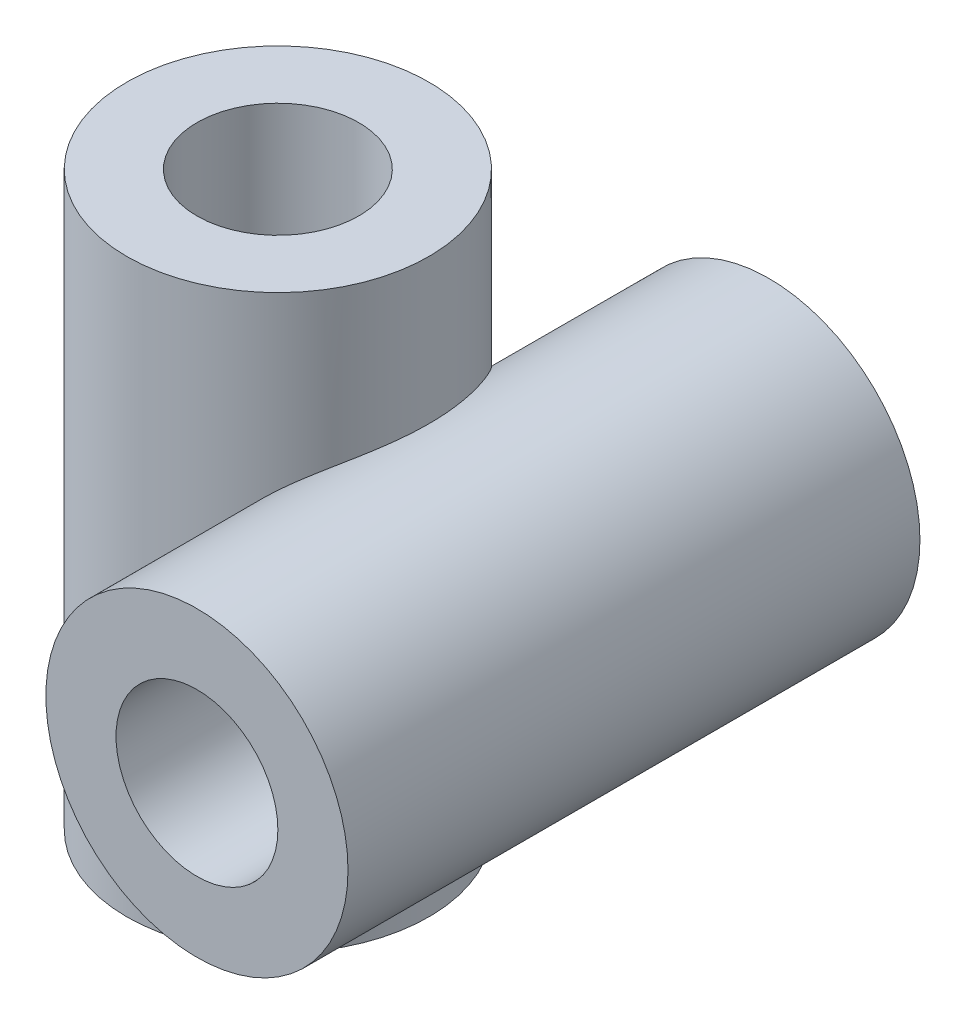
from build123d import *

# Parameters (mm, degrees)
SKETCH1_R           = 28
SKETCH1_R_2         = 15
BOSS_EXTRUDE1_DEPTH = 106
BOSS_EXTRUDE3_DEPTH = 53
CUT_EXTRUDE1_DEPTH  = 128
CUT_EXTRUDE2_DEPTH  = 123


with BuildPart() as part:
    # Sketch1 → Boss-Extrude1 (new body)
    with BuildSketch(Plane.XY):
        Circle(SKETCH1_R)
        Circle(SKETCH1_R_2, mode=Mode.SUBTRACT)
    extrude(amount=BOSS_EXTRUDE1_DEPTH)

    # Sketch2 → Boss-Extrude3 (add, symmetric)
    with BuildSketch(Plane(origin=(0, 0, 0), x_dir=(1, 0, 0), z_dir=(0, 1, 0))):
        with BuildLine():
            ThreePointArc((-28, -26.846606339), (-66, -53), (-28, -79.153393661))
            Line((-28, -79.153393661), (-28, -64.180339887))
            ThreePointArc((-28, -64.180339887), (-53, -53), (-28, -41.819660113))
            Line((-28, -41.819660113), (-28, -26.846606339))
        make_face()
        with BuildLine():
            Line((-28, -64.180339887), (-28, -79.153393661))
            ThreePointArc((-28, -79.153393661), (-14.934874811, -68.874507866), (-10, -53))
            ThreePointArc((-10, -53), (-14.934874811, -37.125492134), (-28, -26.846606339))
            Line((-28, -26.846606339), (-28, -41.819660113))
            ThreePointArc((-28, -41.819660113), (-24.306936062, -46.876275643), (-23, -53))
            ThreePointArc((-23, -53), (-24.306936062, -59.123724357), (-28, -64.180339887))
        make_face()
    extrude(amount=BOSS_EXTRUDE3_DEPTH, both=True)

    # Sketch3 → Cut-Extrude1 (cut, symmetric)
    with BuildSketch(Plane.XY):
        with BuildLine():
            Line((-10, 11.180339887), (-10, -11.180339887))
            ThreePointArc((-10, -11.180339887), (-15, 0), (-10, 11.180339887))
        make_face()
    extrude(amount=CUT_EXTRUDE1_DEPTH, both=True, mode=Mode.SUBTRACT)

    # Sketch4 → Cut-Extrude2 (cut, symmetric)
    with BuildSketch(Plane(origin=(0, 0, 0), x_dir=(1, 0, 0), z_dir=(0, 1, 0))):
        with BuildLine():
            Line((-28, -64.180339887), (-28, -41.819660113))
            ThreePointArc((-28, -41.819660113), (-23, -53), (-28, -64.180339887))
        make_face()
    extrude(amount=CUT_EXTRUDE2_DEPTH, both=True, mode=Mode.SUBTRACT)


solid = part.part
